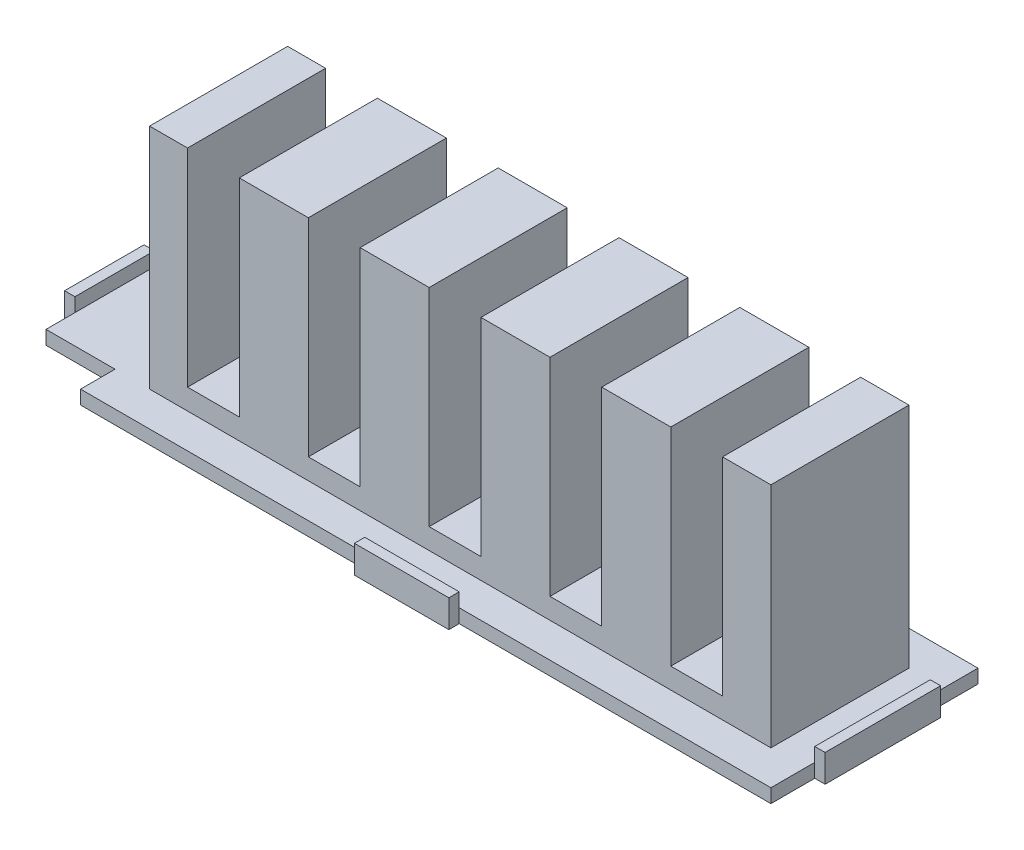
from build123d import *

# Parameters (mm, degrees)
EXTRUDE_1_DEPTH     = 2
SKETCH_2_W          = 90
SKETCH_2_H          = 20
EXTRUDE_2_DEPTH     = 3
SKETCH_3_W          = 10
SKETCH_3_H          = 20
SKETCH_3_W_2        = 5.5
SKETCH_3_W_3        = 7
EXTRUDE_3_DEPTH     = 30
SKETCH_4_R          = 3.25
CUT_EXTRUDE_1_DEPTH = 4
SKETCH_5_W          = 13.678161833
SKETCH_5_H          = 1.5
SKETCH_5_W_2        = 1.5
SKETCH_5_H_2        = 16.732170562
SKETCH_5_H_3        = 11.514895911
EXTRUDE_4_DEPTH     = 4


with BuildPart() as part:
    # 草图1 → 凸台-拉伸1 (new body)
    with BuildSketch(Plane(origin=(0, 0, 0), x_dir=(1, 0, 0), z_dir=(0, 1, 0))):
        Polygon((10, 15), (10, 10), (0, 10), (0, -10), (10, -10), (10, -15), (110, -15), (110, 15), align=None)
    extrude(amount=EXTRUDE_1_DEPTH)

    # 草图2 → 凸台-拉伸2 (add)
    with BuildSketch(Plane(origin=(0, 2, 0), x_dir=(1, 0, 0), z_dir=(0, 1, 0))):
        with Locations((60, 0)):
            Rectangle(SKETCH_2_W, SKETCH_2_H)
    extrude(amount=EXTRUDE_2_DEPTH)

    # 草图3 → 凸台-拉伸3 (add)
    with BuildSketch(Plane(origin=(0, 5, 0), x_dir=(1, 0, 0), z_dir=(0, 1, 0))):
        with Locations((85.5, 0)):
            Rectangle(SKETCH_3_W, SKETCH_3_H)
        with Locations((68, 0)):
            Rectangle(SKETCH_3_W, SKETCH_3_H)
        with Locations((50.5, 0)):
            Rectangle(SKETCH_3_W, SKETCH_3_H)
        with Locations((33, 0)):
            Rectangle(SKETCH_3_W, SKETCH_3_H)
        with Locations((17.75, 0)):
            Rectangle(SKETCH_3_W_2, SKETCH_3_H)
        with Locations((101.5, 0)):
            Rectangle(SKETCH_3_W_3, SKETCH_3_H)
    extrude(amount=EXTRUDE_3_DEPTH)

    # 草图4 → 切除-拉伸1 (cut)
    with BuildSketch(Plane.ZY.offset(-15)):
        with Locations((0, 7)):
            Circle(SKETCH_4_R)
    extrude(amount=-CUT_EXTRUDE_1_DEPTH, mode=Mode.SUBTRACT)

    # 草图5 → 凸台-拉伸4 (add)
    with BuildSketch(Plane(origin=(0, 0, 0), x_dir=(1, 0, 0), z_dir=(0, 1, 0))):
        with Locations((58.012206535, -15.75)):
            Rectangle(SKETCH_5_W, SKETCH_5_H)
        with Locations((58.012206535, 15.75)):
            Rectangle(SKETCH_5_W, SKETCH_5_H)
        with Locations((110.75, -0.281087738)):
            Rectangle(SKETCH_5_W_2, SKETCH_5_H_2)
        with Locations((-0.75, -0.048934151)):
            Rectangle(SKETCH_5_W_2, SKETCH_5_H_3)
    extrude(amount=EXTRUDE_4_DEPTH)


solid = part.part
